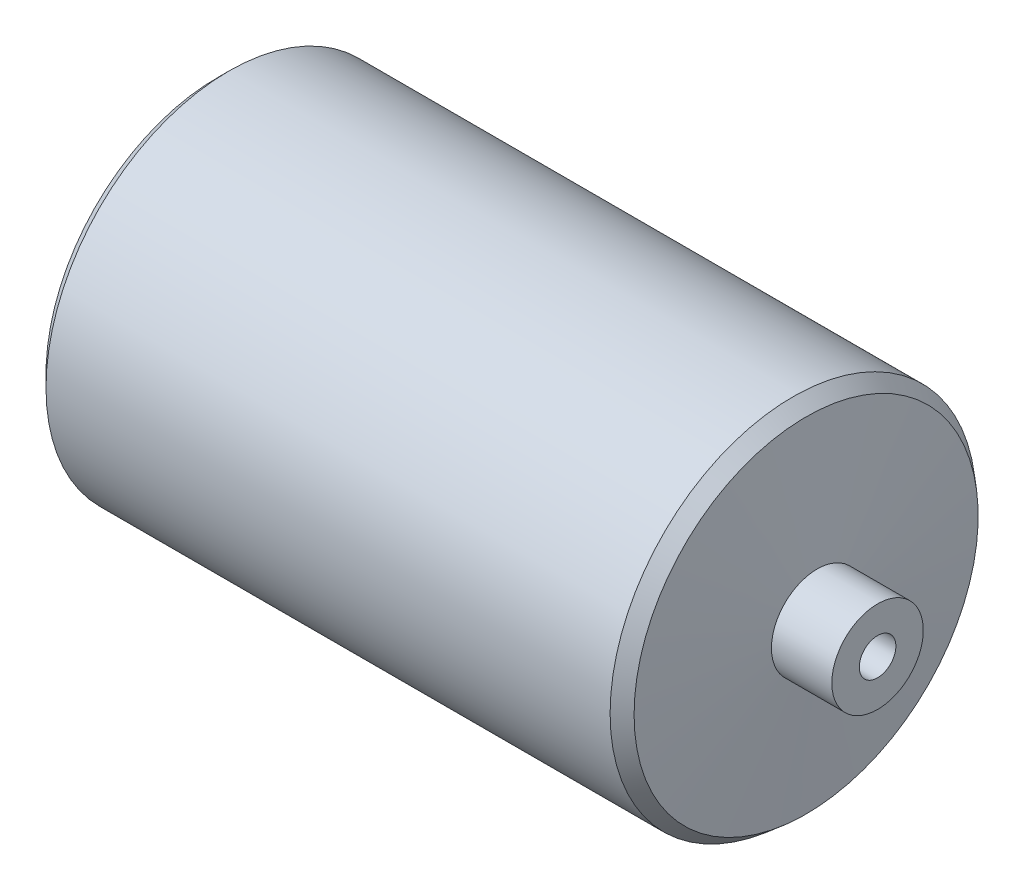
from build123d import *
from OCP.BRepFilletAPI import BRepFilletAPI_MakeChamfer

# Parameters (mm, degrees)
CHAMFER1_SIZE              = 3
CHAMFER1_SIZE2             = 3.300188603
F_10_0MM_DOWEL_HOLE1_D     = 10
F_10_0MM_DOWEL_HOLE1_DEPTH = 59
F_10_0MM_DOWEL_HOLE1_TIP   = 3.004303095
F_10_0MM_DOWEL_HOLE2_D     = 10
F_10_0MM_DOWEL_HOLE2_DEPTH = 59
F_10_0MM_DOWEL_HOLE2_TIP   = 3.004303095


with BuildPart() as part:
    # Sketch1 → Revolve1 (revolve)
    with BuildSketch(Plane.XY):
        Polygon((-96.096096096, 28.340840841), (103.903903904, 28.340840841), (103.903903904, 40.840840841), (87.403903904, 40.840840841), (84.123079022, 78.340840841), (-76.315271214, 78.340840841), (-79.596096096, 40.840840841), (-96.096096096, 40.840840841), align=None)
    revolve(axis=Axis((-96.096096096, 28.340840841, 0), (1, 0, 0)))

    # Chamfer1: one chamfer whose edges measure the first distance from different faces: ONE call of the kernel's chamfer builder (chamfer() names one face for all edges)
    chamfer1_edges_1 = [part.edges().sort_by_distance(p)[0] for p in [
        (84.123079022, -21.659159159, 0),
    ]]
    chamfer1_side_1 = [part.faces().sort_by_distance(p)[0] for p in [
        (85.763491463, -2.909159159, 0),
    ]]
    chamfer1_edges_2 = [part.edges().sort_by_distance(p)[0] for p in [
        (-76.315271214, -21.659159159, 0),
    ]]
    chamfer1_side_2 = [part.faces().sort_by_distance(p)[0] for p in [
        (3.903903904, -21.659159159, 0),
    ]]
    chamfer1 = BRepFilletAPI_MakeChamfer(part.part.solid().wrapped)
    for e in chamfer1_edges_1:
        chamfer1.Add(CHAMFER1_SIZE, CHAMFER1_SIZE2, e.wrapped, chamfer1_side_1[0].wrapped)  # the first distance lies on this face
    for e in chamfer1_edges_2:
        chamfer1.Add(CHAMFER1_SIZE, CHAMFER1_SIZE2, e.wrapped, chamfer1_side_2[0].wrapped)  # the first distance lies on this face
    add(Compound.cast(chamfer1.Shape()), mode=Mode.REPLACE)

    # Ø10.0mm Dowel Hole1
    with Locations(Plane(origin=(103.903903904, 0, 0), x_dir=(0, 0, -1), z_dir=(1, 0, 0))):
        with Locations((0, 28.340840841)):
            Hole(F_10_0MM_DOWEL_HOLE1_D / 2, depth=F_10_0MM_DOWEL_HOLE1_DEPTH)
            with Locations((0, 0, -(F_10_0MM_DOWEL_HOLE1_DEPTH + F_10_0MM_DOWEL_HOLE1_TIP / 2))):  # 118° drill point
                Cone(0, F_10_0MM_DOWEL_HOLE1_D / 2, F_10_0MM_DOWEL_HOLE1_TIP, mode=Mode.SUBTRACT)

    # Ø10.0mm Dowel Hole2
    with Locations(Plane.ZY.offset(96.096096096)):
        with Locations((0, 28.340840841)):
            Hole(F_10_0MM_DOWEL_HOLE2_D / 2, depth=F_10_0MM_DOWEL_HOLE2_DEPTH)
            with Locations((0, 0, -(F_10_0MM_DOWEL_HOLE2_DEPTH + F_10_0MM_DOWEL_HOLE2_TIP / 2))):  # 118° drill point
                Cone(0, F_10_0MM_DOWEL_HOLE2_D / 2, F_10_0MM_DOWEL_HOLE2_TIP, mode=Mode.SUBTRACT)


solid = part.part
